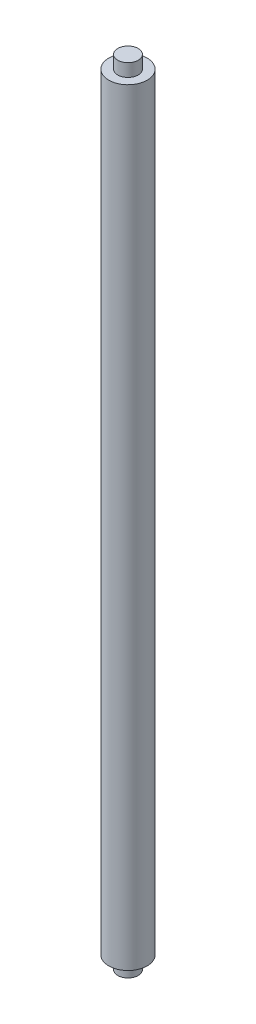
from build123d import *

# Parameters (mm, degrees)
SKETCH_1_R      = 0.8
EXTRUDE_1_DEPTH = 31
SKETCH_2_R      = 1.5
EXTRUDE_2_DEPTH = 30


with BuildPart() as part:
    # 草图1 → 凸台-拉伸1 (new, symmetric)
    with BuildSketch(Plane(origin=(0, 0, 0), x_dir=(1, 0, 0), z_dir=(0, 1, 0))):
        with Locations(Location((0, 0, 0), (0, 0, 270))):
            Circle(SKETCH_1_R)
    extrude(amount=EXTRUDE_1_DEPTH, both=True)

    # 草图2 → 凸台-拉伸2 (add, symmetric)
    with BuildSketch(Plane(origin=(0, 0, 0), x_dir=(1, 0, 0), z_dir=(0, 1, 0))):
        with Locations(Location((0, 0, 0), (0, 0, 270))):
            Circle(SKETCH_2_R)
    extrude(amount=EXTRUDE_2_DEPTH, both=True)


solid = part.part
